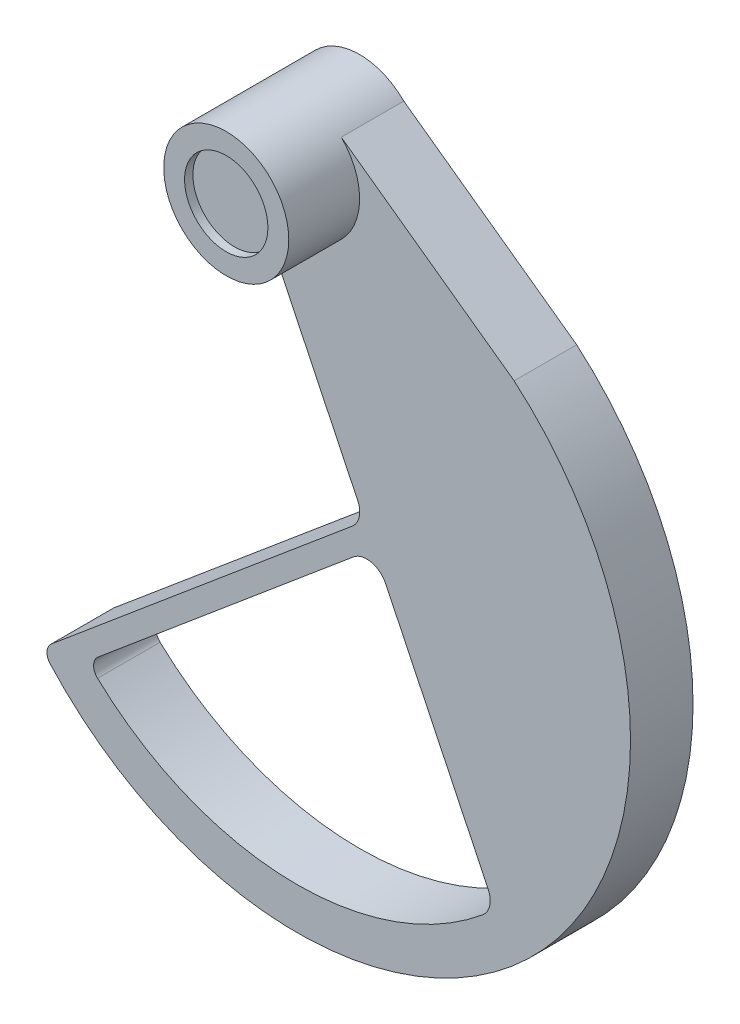
from build123d import *

# Parameters (mm, degrees)
EXTRUDE_1_DEPTH     = 15
SKETCH_5_R          = 15
EXTRUDE_2_DEPTH     = 17
SKETCH_7_R          = 10
CUT_EXTRUDE_1_DEPTH = 2


with BuildPart() as part:
    # ｽｹｯﾁ4 → ﾎﾞｽ - 押し出し1 (new body)
    with BuildSketch(Plane.XY):
        with BuildLine():
            Line((-53.623111018, -124.995132678), (-58.940636287, -129.45706617))
            ThreePointArc((-58.940636287, -129.45706617), (-60.005384698, -131.552012131), (-59.233530865, -133.771635843))
            ThreePointArc((-59.233530865, -133.771635843), (57.362306223, -135.763481103), (52.076178918, -19.270504783))
            Line((52.076178918, -19.270504783), (10.606601718, 10.606601718))
            ThreePointArc((10.606601718, 10.606601718), (-10.606601718, 10.606601718), (-10.606601718, -10.606601718))
            Line((-10.606601718, -10.606601718), (14.536280154, -62.889638219))
            ThreePointArc((14.536280154, -62.889638219), (14.918089499, -66.109676181), (13.244185189, -68.886809092))
            Line((13.244185189, -68.886809092), (-53.623111018, -124.995132678))
        make_face()
        with BuildLine():
            Line((21.232400696, -76.813798404), (45.844843506, -127.993820346))
            ThreePointArc((45.844843506, -127.993820346), (46.221944165, -131.235480845), (44.518718993, -134.019289696))
            ThreePointArc((44.518718993, -134.019289696), (-2.231208213, -149.964431749), (-47.870174388, -131.072951785))
            ThreePointArc((-47.870174388, -131.072951785), (-48.817477846, -128.802229421), (-47.747678417, -126.586582094))
            Line((-47.747678417, -126.586582094), (13.511229465, -75.151532228))
            ThreePointArc((13.511229465, -75.151532228), (17.77869109, -74.092739753), (21.232400696, -76.813798404))
        make_face(mode=Mode.SUBTRACT)
    extrude(amount=EXTRUDE_1_DEPTH)

    # ｽｹｯﾁ5 → ﾎﾞｽ - 押し出し2 (add)
    with BuildSketch(Plane.XY.offset(15)):
        with Locations(Location((0, 0, 0), (0, 0, 225))):
            Circle(SKETCH_5_R)
    extrude(amount=EXTRUDE_2_DEPTH)

    # ｽｹｯﾁ7 → ｶｯﾄ - 押し出し1 (cut)
    with BuildSketch(Plane.XY.offset(32)):
        Circle(SKETCH_7_R)
    extrude(amount=-CUT_EXTRUDE_1_DEPTH, mode=Mode.SUBTRACT)


solid = part.part
